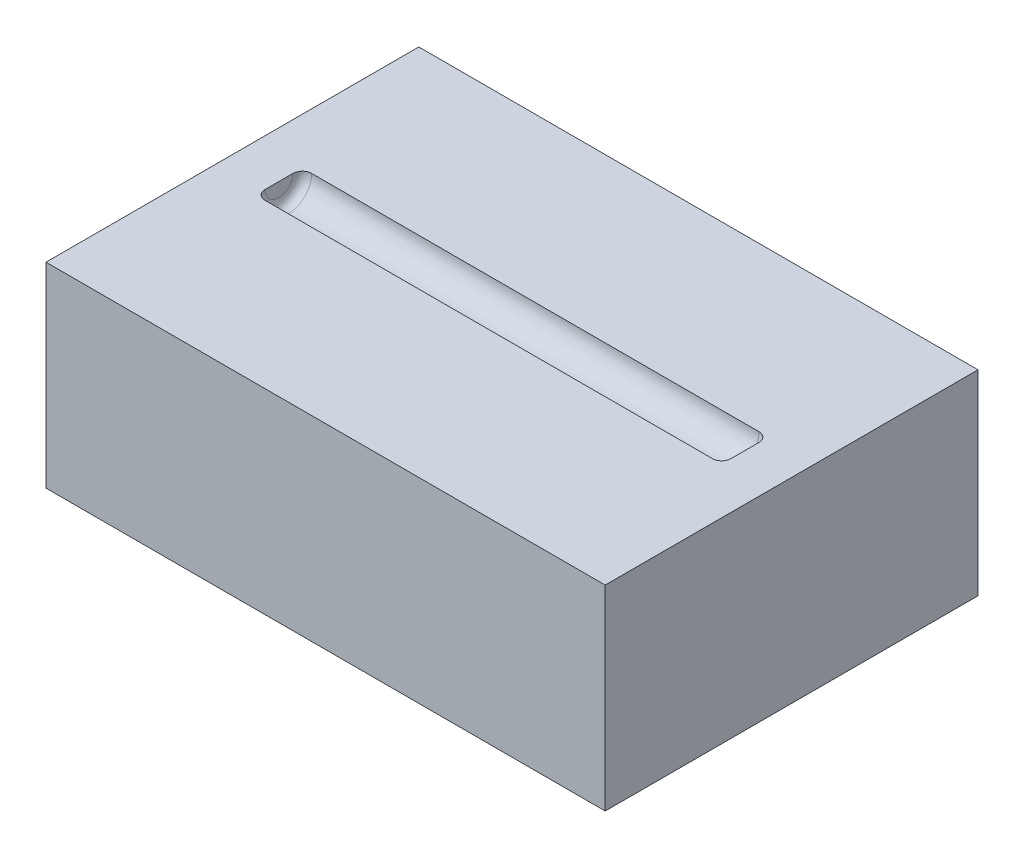
from build123d import *

# Parameters (mm, degrees)
SKETCH1_W           = 152.4
SKETCH1_H           = 101.6
BOSS_EXTRUDE1_DEPTH = 53.34
CUT_EXTRUDE1_START  = -12.7
SKETCH2_R           = 6.35
CUT_EXTRUDE1_DEPTH  = 127
FILLET2_R           = 2.54


with BuildPart() as part:
    # Sketch1 → Boss-Extrude1 (new body)
    with BuildSketch(Plane(origin=(0, 0, 0), x_dir=(1, 0, 0), z_dir=(0, 1, 0))):
        Rectangle(SKETCH1_W, SKETCH1_H)
    extrude(amount=-BOSS_EXTRUDE1_DEPTH)

    # Sketch2 → Cut-Extrude1 (cut)
    with BuildSketch(Plane(origin=(76.2, 0, 0), x_dir=(0, 0, -1), z_dir=(1, 0, 0)).offset(CUT_EXTRUDE1_START)):
        Circle(SKETCH2_R)
    extrude(amount=-CUT_EXTRUDE1_DEPTH, mode=Mode.SUBTRACT)

    # Fillet2
    fillet2_edges = [part.edges().sort_by_distance(p)[0] for p in [
        (63.5, -6.35, 0),
        (-63.5, -6.35, 0),
    ]]
    fillet(fillet2_edges, radius=FILLET2_R)


solid = part.part
